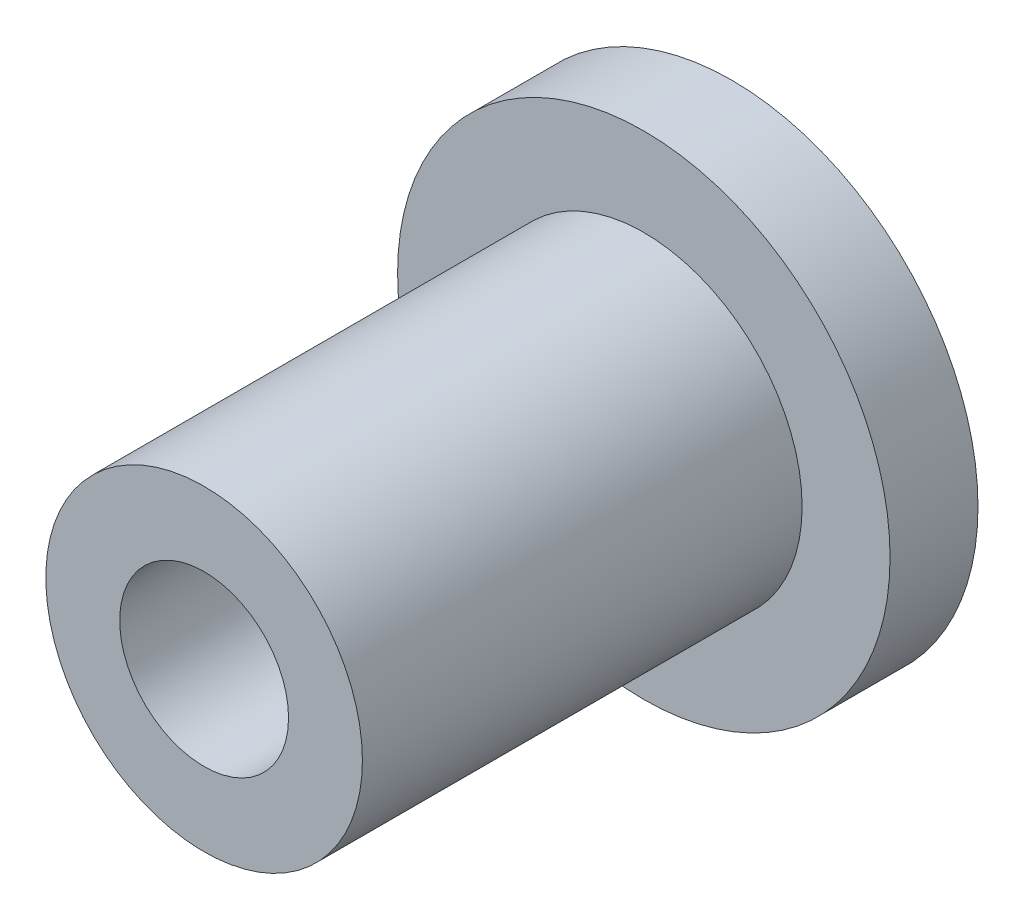
from build123d import *

# Parameters (mm, degrees)
SKETCH1_R           = 7
BOSS_EXTRUDE1_DEPTH = 2.5
SKETCH2_R           = 4.5
BOSS_EXTRUDE2_DEPTH = 12.5
SKETCH3_R           = 2.4
CUT_EXTRUDE1_DEPTH  = 5


with BuildPart() as part:
    # Sketch1 → Boss-Extrude1 (new body)
    with BuildSketch(Plane.XY):
        Circle(SKETCH1_R)
    extrude(amount=BOSS_EXTRUDE1_DEPTH)

    # Sketch2 → Boss-Extrude2 (add)
    with BuildSketch(Plane.XY.offset(2.5)):
        Circle(SKETCH2_R)
    extrude(amount=BOSS_EXTRUDE2_DEPTH)

    # Sketch3 → Cut-Extrude1 (cut)
    with BuildSketch(Plane.XY.offset(15)):
        Circle(SKETCH3_R)
    extrude(amount=-CUT_EXTRUDE1_DEPTH, mode=Mode.SUBTRACT)


solid = part.part
